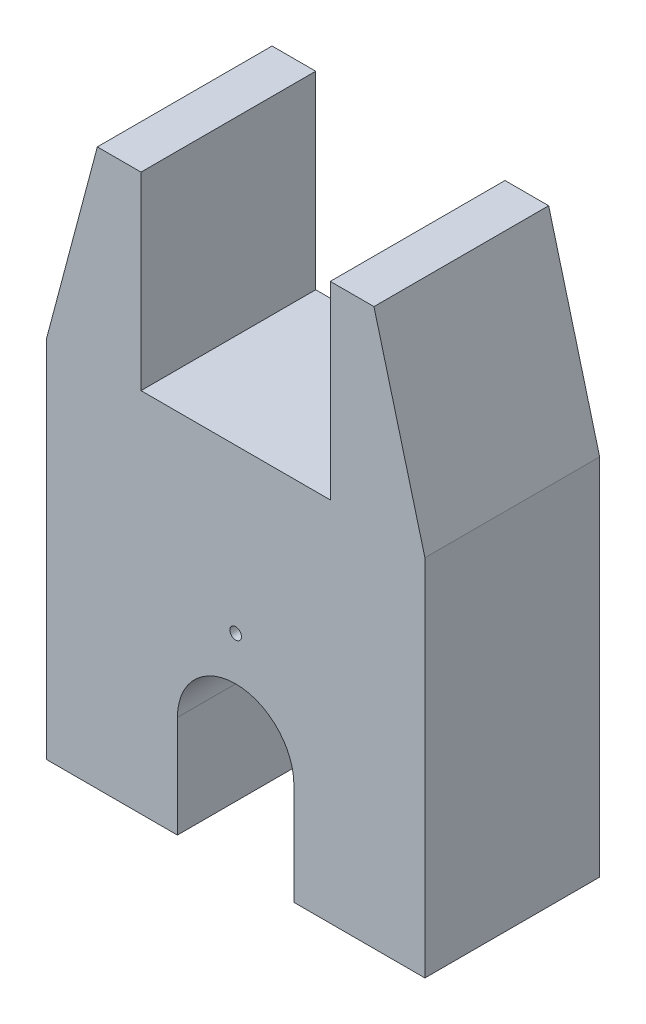
from build123d import *

# Parameters (mm, degrees)
BOSS_EXTRUDE1_DEPTH = 1524
CUT_EXTRUDE1_DEPTH  = 4554.780373204
SKETCH3_W           = 1651
SKETCH3_H           = 1651
CUT_EXTRUDE2_DEPTH  = 4554.780373204
HOLE1_D             = 101.6
HOLE1_DEPTH         = 762
HOLE1_TIP           = 30.523719447


with BuildPart() as part:
    # Sketch1 → Boss-Extrude1 (new body)
    with BuildSketch(Plane.XY.offset(1524)):
        Polygon((-1651, 2286), (-1651, -889), (1651, -889), (1651, 2286), (1206.5, 3960.876), (-1206.5, 3960.876), align=None)
    extrude(amount=-BOSS_EXTRUDE1_DEPTH)

    # Sketch2 → Cut-Extrude1 (cut, through all)
    with BuildSketch(Plane(origin=(0, 0, 0), x_dir=(-1, 0, 0), z_dir=(0, 0, -1))):
        with BuildLine():
            Line((-508, -889), (508, -889))
            Line((508, -889), (508, 0))
            ThreePointArc((508, 0), (0, 508), (-508, 0))
            Line((-508, 0), (-508, -889))
        make_face()
    extrude(amount=-CUT_EXTRUDE1_DEPTH, mode=Mode.SUBTRACT)

    # Sketch3 → Cut-Extrude2 (cut, through all)
    with BuildSketch(Plane(origin=(0, 0, 0), x_dir=(-1, 0, 0), z_dir=(0, 0, -1))):
        with Locations((0, 3135.376)):
            Rectangle(SKETCH3_W, SKETCH3_H)
    extrude(amount=-CUT_EXTRUDE2_DEPTH, mode=Mode.SUBTRACT)

    # Hole1
    with Locations(Plane.XY.offset(1524)):
        with Locations((0, 889)):
            Hole(HOLE1_D / 2, depth=HOLE1_DEPTH)
            with Locations((0, 0, -(HOLE1_DEPTH + HOLE1_TIP / 2))):  # 118° drill point
                Cone(0, HOLE1_D / 2, HOLE1_TIP, mode=Mode.SUBTRACT)


solid = part.part
